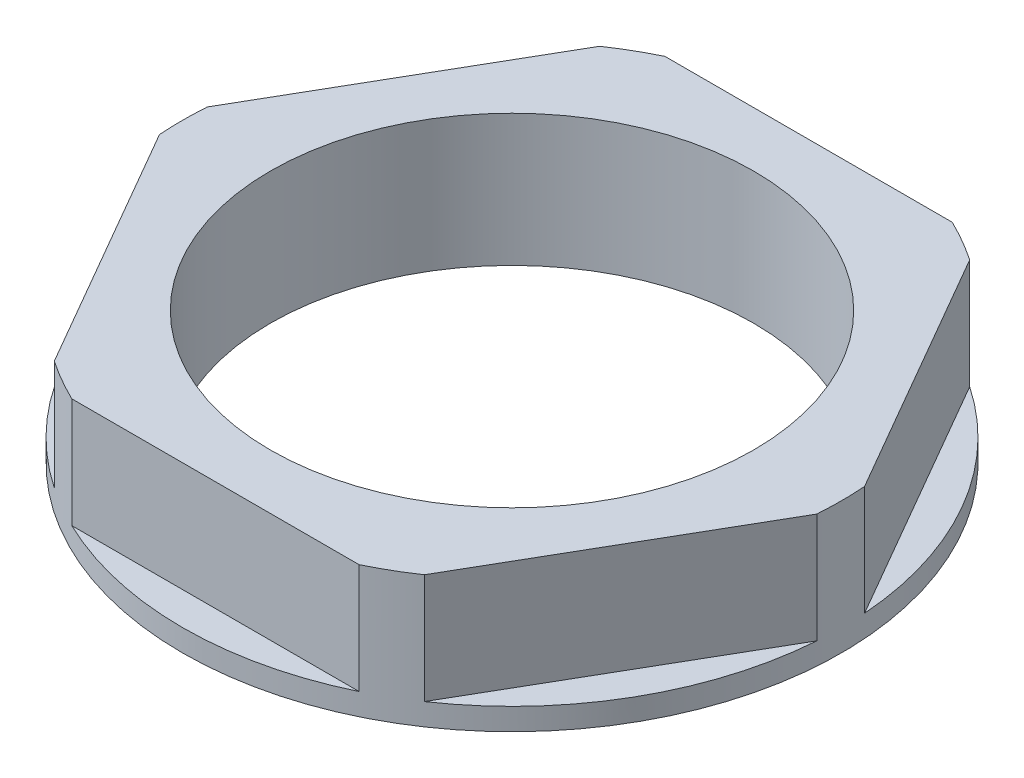
from build123d import *

# Parameters (mm, degrees)
SKIZZE1_R                       = 15
SKIZZE1_R_2                     = 11
AUFSATZ_LINEAR_AUSTRAGEN1_DEPTH = 1
SKIZZE2_R                       = 11
AUFSATZ_LINEAR_AUSTRAGEN2_DEPTH = 5
SKIZZE3_R                       = 15.588457268
SKIZZE3_R_2                     = 15
SCHNITT_LINEAR_AUSTRAGEN2_DEPTH = 23.449944321


with BuildPart() as part:
    # Skizze1 → Aufsatz-Linear austragen1 (new body)
    with BuildSketch(Plane(origin=(0, 0, 0), x_dir=(1, 0, 0), z_dir=(0, 1, 0))):
        with Locations(Location((0, 0, 0), (0, 0, 270))):
            Circle(SKIZZE1_R)
        with Locations(Location((0, 0, 0), (0, 0, 270))):
            Circle(SKIZZE1_R_2, mode=Mode.SUBTRACT)
    extrude(amount=AUFSATZ_LINEAR_AUSTRAGEN1_DEPTH)

    # Skizze2 → Aufsatz-Linear austragen2 (add)
    with BuildSketch(Plane(origin=(0, 1, 0), x_dir=(1, 0, 0), z_dir=(0, 1, 0))):
        Polygon((15.588457268, 0), (7.794228634, 13.5), (-7.794228634, 13.5), (-15.588457268, 0), (-7.794228634, -13.5), (7.794228634, -13.5), align=None)
        with Locations(Location((0, 0, 0), (0, 0, 270))):
            Circle(SKIZZE2_R, mode=Mode.SUBTRACT)
    extrude(amount=AUFSATZ_LINEAR_AUSTRAGEN2_DEPTH)

    # Skizze3 → Schnitt-Linear austragen2 (cut, through all)
    with BuildSketch(Plane(origin=(0, 6, 0), x_dir=(1, 0, 0), z_dir=(0, 1, 0))):
        Circle(SKIZZE3_R)
        with Locations(Location((0, 0, 0), (0, 0, 115.841932763))):
            Circle(SKIZZE3_R_2, mode=Mode.SUBTRACT)
    extrude(amount=-SCHNITT_LINEAR_AUSTRAGEN2_DEPTH, mode=Mode.SUBTRACT)


solid = part.part
